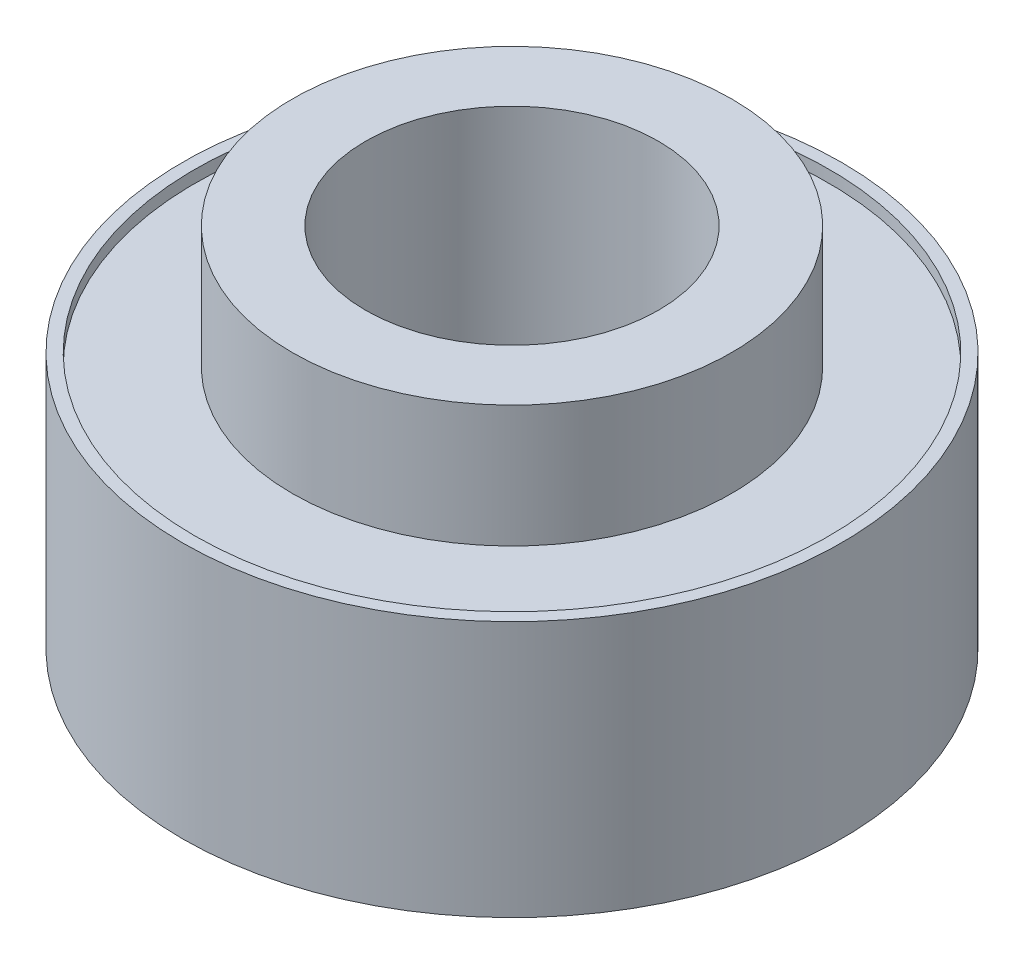
from build123d import *

# Parameters (mm, degrees)
SKETCH_1_R          = 13.5
EXTRUDE_1_DEPTH     = 10.5
SKETCH_2_R          = 13
CUT_EXTRUDE_1_DEPTH = 0.5
CUT_EXTRUDE_START   = -0.5
SKETCH_3_R          = 13
CUT_EXTRUDE_2_DEPTH = 0.5
SKETCH_4_R          = 6
CUT_EXTRUDE_3_DEPTH = 22.552262062
EXTRUDE_START       = 5
SKETCH_5_R          = 9
SKETCH_5_R_2        = 6
EXTRUDE_2_DEPTH     = 5
SKETCH_6_R          = 9
SKETCH_6_R_2        = 6
EXTRUDE_3_DEPTH     = 1.5


with BuildPart() as part:
    # Эскиз1 → Бобышка-Вытянуть1 (new body)
    with BuildSketch(Plane(origin=(0, 0, 0), x_dir=(1, 0, 0), z_dir=(0, 1, 0))):
        with Locations(Location((0, 0, 0), (0, 0, 90))):
            Circle(SKETCH_1_R)
    extrude(amount=EXTRUDE_1_DEPTH)

    # Эскиз2 → Вырез-Вытянуть1 (cut)
    with BuildSketch(Plane(origin=(0, 10.5, 0), x_dir=(1, 0, 0), z_dir=(0, 1, 0))):
        with Locations(Location((0, 0, 0), (0, 0, 270))):
            Circle(SKETCH_2_R)
    extrude(amount=-CUT_EXTRUDE_1_DEPTH, mode=Mode.SUBTRACT)

    # Эскиз3 → Вырез-Вытянуть2 (cut)
    with BuildSketch(Plane.XZ.offset(CUT_EXTRUDE_START)):
        with Locations(Location((0, 0, 0), (0, 0, 90))):
            Circle(SKETCH_3_R)
    extrude(amount=CUT_EXTRUDE_2_DEPTH, mode=Mode.SUBTRACT)

    # Эскиз4 → Вырез-Вытянуть3 (cut, through all)
    with BuildSketch(Plane(origin=(0, 10, 0), x_dir=(1, 0, 0), z_dir=(0, 1, 0))):
        with Locations(Location((0, 0, 0), (0, 0, 270))):
            Circle(SKETCH_4_R)
    extrude(amount=-CUT_EXTRUDE_3_DEPTH, mode=Mode.SUBTRACT)

    # Эскиз5 → Бобышка-Вытянуть2 (add)
    with BuildSketch(Plane(origin=(0, 10, 0), x_dir=(1, 0, 0), z_dir=(0, 1, 0)).offset(EXTRUDE_START)):
        with Locations(Location((0, 0, 0), (0, 0, 270))):
            Circle(SKETCH_5_R)
        with Locations(Location((0, 0, 0), (0, 0, 270))):
            Circle(SKETCH_5_R_2, mode=Mode.SUBTRACT)
    extrude(amount=-EXTRUDE_2_DEPTH)

    # Эскиз6 → Бобышка-Вытянуть3 (add)
    with BuildSketch(Plane.XZ.offset(-0.5)):
        with Locations(Location((0, 0, 0), (0, 0, 90))):
            Circle(SKETCH_6_R)
        with Locations(Location((0, 0, 0), (0, 0, 90))):
            Circle(SKETCH_6_R_2, mode=Mode.SUBTRACT)
    extrude(amount=EXTRUDE_3_DEPTH)


solid = part.part
